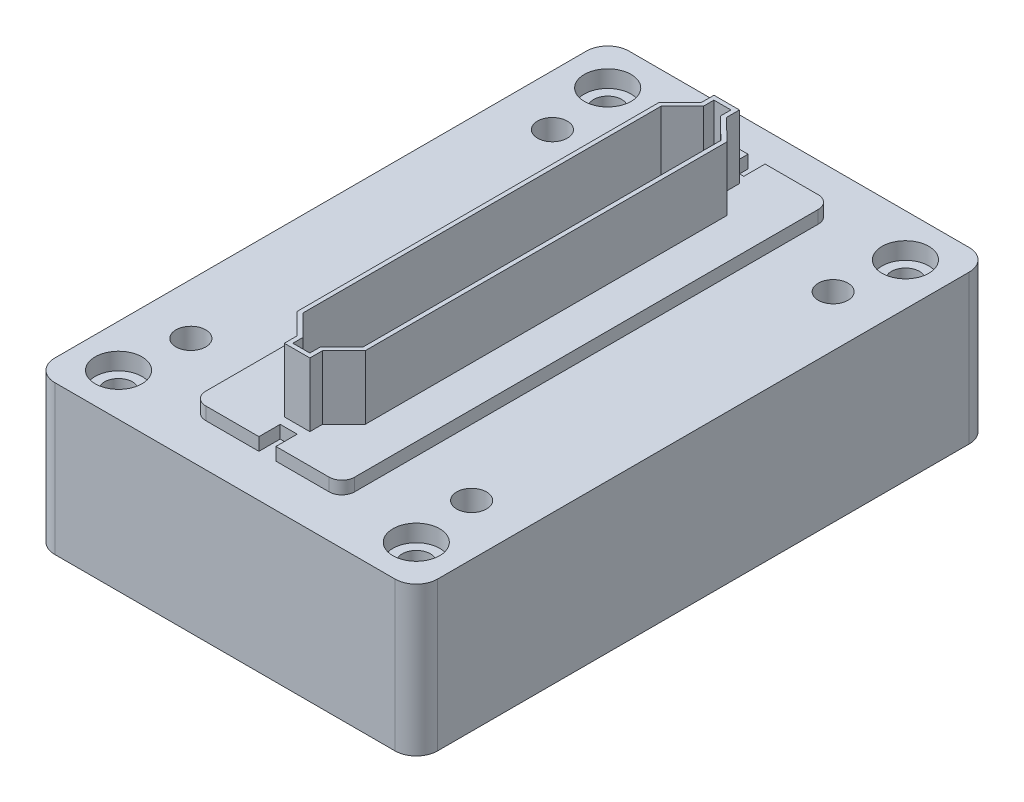
from build123d import *

# Parameters (mm, degrees)
SKETCH2_W               = 90
SKETCH2_H               = 135
BOSS_EXTRUDE1_DEPTH     = 35
FILLET1_R               = 5
SKETCH8_R               = 3.5
CUT_EXTRUDE1_DEPTH      = 10
MIRROR2_COPY_2_SKETCH_R = 3.5
MIRROR2_COPY_2_DEPTH    = 10
BOSS_EXTRUDE2_DEPTH     = 3
BOSS_EXTRUDE3_DEPTH     = 15


with BuildPart() as part:
    # Sketch2 → Boss-Extrude1 (new body)
    with BuildSketch(Plane(origin=(0, 0, 0), x_dir=(1, 0, 0), z_dir=(0, 1, 0))):
        Rectangle(SKETCH2_W, SKETCH2_H)
    extrude(amount=BOSS_EXTRUDE1_DEPTH)

    # Fillet1
    fillet1_edges = [part.edges().sort_by_distance(p)[0] for p in [
        (-45, 17.5, -67.5),
        (45, 17.5, -67.5),
        (45, 17.5, 67.5),
        (-45, 17.5, 67.5),
    ]]
    fillet(fillet1_edges, radius=FILLET1_R)

    # Sketch6 → CBORE for M6 Hex Head Bolt1 (revolve, cut)
    with BuildSketch(Plane(origin=(-35, 35, -57.5), x_dir=(0, 0, 1), z_dir=(1, 0, 0))):
        Polygon((0, 0), (0, 43.982840043), (3.3, 42), (3.3, 4), (5.5, 4), (5.5, 0), align=None)
    cbore_for_m6_hex_head_bolt1 = revolve(axis=Axis((-35, 41.35, -57.5), (0, -1, 0)), mode=Mode.SUBTRACT)

    # Sketch8 → Cut-Extrude1 (cut)
    with BuildSketch(Plane(origin=(0, 35, 0), x_dir=(1, 0, 0), z_dir=(0, 1, 0))):
        with Locations(Location((-33, 42.5, 0), (0, 0, 270))):
            Circle(SKETCH8_R)
    cut_extrude1 = extrude(amount=-CUT_EXTRUDE1_DEPTH, mode=Mode.SUBTRACT)

    # Mirror1: CBORE for M6 Hex Head Bolt1, Cut-Extrude1 across plane
    add(cbore_for_m6_hex_head_bolt1.mirror(Plane(origin=(0, 0, 0), x_dir=(0, 0, 1), z_dir=(1, 0, 0))), mode=Mode.SUBTRACT)
    add(cut_extrude1.mirror(Plane(origin=(0, 0, 0), x_dir=(0, 0, 1), z_dir=(1, 0, 0))), mode=Mode.SUBTRACT)

    # Mirror2: CBORE for M6 Hex Head Bolt1, Cut-Extrude1 across plane
    add(cbore_for_m6_hex_head_bolt1.mirror(Plane.XY), mode=Mode.SUBTRACT)
    add(cut_extrude1.mirror(Plane.XY), mode=Mode.SUBTRACT)

    # Mirror2 copy 1 sketch → Mirror2 copy 1 (revolve, cut)
    with BuildSketch(Plane(origin=(35, 35, 57.5), x_dir=(0, 0, -1), z_dir=(-1, 0, 0))):
        Polygon((0, 0), (0, 43.982840043), (3.3, 42), (3.3, 4), (5.5, 4), (5.5, 0), align=None)
    revolve(axis=Axis((35, 41.35, 57.5), (0, -1, 0)), mode=Mode.SUBTRACT)

    # Mirror2 copy 2 sketch → Mirror2 copy 2 (cut)
    with BuildSketch(Plane(origin=(0, 35, 0), x_dir=(-1, 0, 0), z_dir=(0, 1, 0))):
        with Locations(Location((-33, 42.5, 0), (0, 0, 270))):
            Circle(MIRROR2_COPY_2_SKETCH_R)
    extrude(amount=-MIRROR2_COPY_2_DEPTH, mode=Mode.SUBTRACT)


with BuildPart() as body_2:
    # Sketch9 → Boss-Extrude2 (new body)
    with BuildSketch(Plane(origin=(0, 35, 0), x_dir=(1, 0, 0), z_dir=(0, 1, 0))):
        with BuildLine():
            Line((14.5, -57.5), (2, -57.5))
            Line((2, -57.5), (2, -52.5))
            Line((2, -52.5), (-2, -52.5))
            Line((-2, -52.5), (-2, -57.5))
            Line((-2, -57.5), (-14.5, -57.5))
            ThreePointArc((-14.5, -57.5), (-16.621320344, -56.621320344), (-17.5, -54.5))
            Line((-17.5, -54.5), (-17.5, 54.5))
            ThreePointArc((-17.5, 54.5), (-16.621320344, 56.621320344), (-14.5, 57.5))
            Line((-14.5, 57.5), (-2, 57.5))
            Line((-2, 57.5), (-2, 52.5))
            Line((-2, 52.5), (2, 52.5))
            Line((2, 52.5), (2, 57.5))
            Line((2, 57.5), (14.5, 57.5))
            ThreePointArc((14.5, 57.5), (16.621320344, 56.621320344), (17.5, 54.5))
            Line((17.5, 54.5), (17.5, -54.5))
            ThreePointArc((17.5, -54.5), (16.621320344, -56.621320344), (14.5, -57.5))
        make_face()
    extrude(amount=BOSS_EXTRUDE2_DEPTH)

    # Sketch10 → Boss-Extrude3 (add)
    with BuildSketch(Plane(origin=(0, 38, 0), x_dir=(1, 0, 0), z_dir=(0, 1, 0))):
        Polygon((2.975253238, 47.5), (8, 42.5), (8, -42.5), (2.975253238, -47.5), (2.975253238, -50.5), (-3.024746762, -50.5), (-3.024746762, -47.5), (-8, -42.5), (-8, 42.5), (-3.024746762, 47.5), (-3.024746762, 50.5), (2.975253238, 50.5), align=None)
        Polygon((7, -42.084339647), (7, 42.084339647), (1.975253238, 47.084339647), (1.975253238, 49.5), (-2.024746762, 49.5), (-2.024746762, 47.087238917), (-7, 42.087238917), (-7, -42.087238917), (-2.024746762, -47.087238917), (-2.024746762, -49.5), (1.975253238, -49.5), (1.975253238, -47.084339647), align=None, mode=Mode.SUBTRACT)
    extrude(amount=BOSS_EXTRUDE3_DEPTH)


solid = Compound([part.part, body_2.part])
